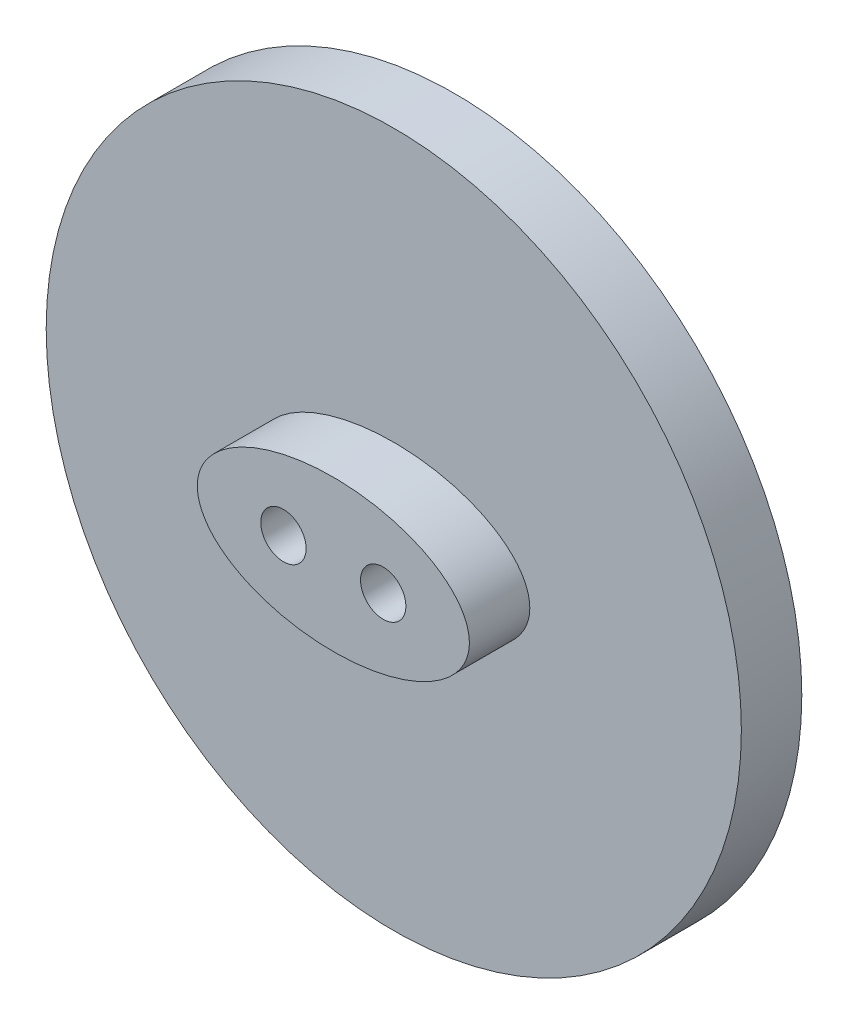
from build123d import *

# Parameters (mm, degrees)
ESQUISSE1_R             = 11.5
BOSS_EXTRU_1_DEPTH      = 2
ESQUISSE6_RX            = 4.5
ESQUISSE6_RY            = 2.5
BOSS_EXTRU_5_DEPTH      = 2
ESQUISSE7_R             = 0.75
ENL_V_MAT_EXTRU_1_DEPTH = 17.748134224


with BuildPart() as part:
    # Esquisse1 → Boss.-Extru.1 (new body)
    with BuildSketch(Plane.XY):
        Circle(ESQUISSE1_R)
    extrude(amount=BOSS_EXTRU_1_DEPTH)

    # Esquisse6 → Boss.-Extru.5 (add)
    with BuildSketch(Plane.XY.offset(2)):
        with Locations((0, 0)):
            Ellipse(ESQUISSE6_RX, ESQUISSE6_RY)
    extrude(amount=BOSS_EXTRU_5_DEPTH)

    # Esquisse7 → Enlèv. mat.-Extru.1 (cut, through all)
    with BuildSketch(Plane(origin=(0, 0, 0), x_dir=(-1, 0, 0), z_dir=(0, 0, -1))):
        with Locations((1.650464666, 0)):
            Circle(ESQUISSE7_R)
        with Locations((-1.650464666, 0)):
            Circle(ESQUISSE7_R)
    extrude(amount=-ENL_V_MAT_EXTRU_1_DEPTH, mode=Mode.SUBTRACT)


solid = part.part
